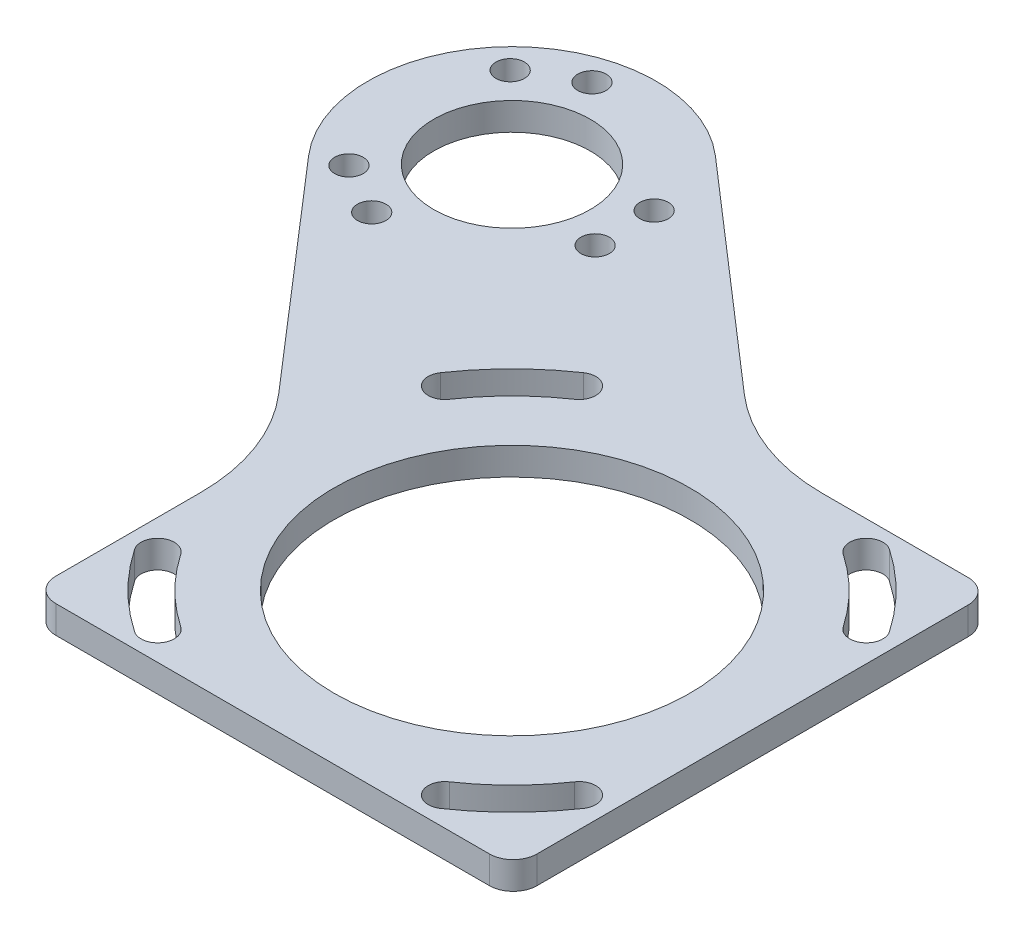
from build123d import *

# Parameters (mm, degrees)
SKETCH1_R           = 23.8125
SKETCH1_R_2         = 10.4775
SKETCH1_R_3         = 1.905
BOSS_EXTRUDE1_DEPTH = 3.683


with BuildPart() as part:
    # Sketch1 → Boss-Extrude1 (new body)
    with BuildSketch(Plane(origin=(0, 0, 0), x_dir=(1, 0, 0), z_dir=(0, 1, 0))):
        with BuildLine():
            Line((-8.06473402, -4.72806869), (-8.06473402, 14.671308994))
            ThreePointArc((-8.06473402, 14.671308994), (-9.661605647, 23.535341917), (-14.251433206, 31.284829748))
            Line((-14.251433206, 31.284829748), (-39.858713959, 60.899286273))
            ThreePointArc((-39.858713959, 60.899286273), (-38.889761495, 87.184032671), (-12.602664438, 88.086967018))
            Line((-12.602664438, 88.086967018), (16.963304526, 62.391553913))
            ThreePointArc((16.963304526, 62.391553913), (24.731110608, 57.771090259), (33.625027761, 56.16306869))
            Line((33.625027761, 56.16306869), (53.14973402, 56.16306869))
            ThreePointArc((53.14973402, 56.16306869), (55.39479805, 55.23313272), (56.32473402, 52.98806869))
            Line((56.32473402, 52.98806869), (56.32473402, -4.72806869))
            ThreePointArc((56.32473402, -4.72806869), (55.39479805, -6.97313272), (53.14973402, -7.90306869))
            Line((53.14973402, -7.90306869), (-4.88973402, -7.90306869))
            ThreePointArc((-4.88973402, -7.90306869), (-7.13479805, -6.97313272), (-8.06473402, -4.72806869))
        make_face()
        with Locations(Location((24.13, 24.13, 0), (0, 0, 270))):
            Circle(SKETCH1_R, mode=Mode.SUBTRACT)
        with Locations(Location((-25.261408666, 73.521408666, 0), (0, 0, 270))):
            Circle(SKETCH1_R_2, mode=Mode.SUBTRACT)
        with Locations(Location((-36.294042469, 84.309426168, 0), (0, 0, 270))):
            Circle(SKETCH1_R_3, mode=Mode.SUBTRACT)
        with Locations(Location((-29.421941059, 88.38042278, 0), (0, 0, 270))):
            Circle(SKETCH1_R_3, mode=Mode.SUBTRACT)
        with Locations(Location((-10.402394551, 77.681941059, 0), (0, 0, 270))):
            Circle(SKETCH1_R_3, mode=Mode.SUBTRACT)
        with Locations(Location((-10.312858771, 69.695028354, 0), (0, 0, 270))):
            Circle(SKETCH1_R_3, mode=Mode.SUBTRACT)
        with Locations(Location((-29.087788977, 58.572858771, 0), (0, 0, 270))):
            Circle(SKETCH1_R_3, mode=Mode.SUBTRACT)
        with Locations(Location((-36.049426168, 62.488774863, 0), (0, 0, 270))):
            Circle(SKETCH1_R_3, mode=Mode.SUBTRACT)
        with BuildLine():
            ThreePointArc((44.60009114, -5.905215683), (49.831544821, -1.571544821), (54.165215683, 3.65990886))
            ThreePointArc((54.165215683, 3.65990886), (53.580347261, 6.748102738), (50.492153383, 6.163234317))
            ThreePointArc((50.492153383, 6.163234317), (46.688455179, 1.571544821), (42.096765683, -2.232153383))
            ThreePointArc((42.096765683, -2.232153383), (41.511897262, -5.320347261), (44.60009114, -5.905215683))
        make_face(mode=Mode.SUBTRACT)
        with BuildLine():
            ThreePointArc((44.60009114, 54.165215683), (49.831544821, 49.831544821), (54.165215683, 44.60009114))
            ThreePointArc((54.165215683, 44.60009114), (53.580347261, 41.511897262), (50.492153383, 42.096765683))
            ThreePointArc((50.492153383, 42.096765683), (46.688455179, 46.688455179), (42.096765683, 50.492153383))
            ThreePointArc((42.096765683, 50.492153383), (41.511897262, 53.580347261), (44.60009114, 54.165215683))
        make_face(mode=Mode.SUBTRACT)
        with BuildLine():
            ThreePointArc((3.65990886, -5.905215683), (-1.571544821, -1.571544821), (-5.905215683, 3.65990886))
            ThreePointArc((-5.905215683, 3.65990886), (-5.320347261, 6.748102738), (-2.232153383, 6.163234317))
            ThreePointArc((-2.232153383, 6.163234317), (1.571544821, 1.571544821), (6.163234317, -2.232153383))
            ThreePointArc((6.163234317, -2.232153383), (6.748102738, -5.320347261), (3.65990886, -5.905215683))
        make_face(mode=Mode.SUBTRACT)
        with BuildLine():
            ThreePointArc((3.65990886, 54.165215683), (-1.571544821, 49.831544821), (-5.905215683, 44.60009114))
            ThreePointArc((-5.905215683, 44.60009114), (-5.320347261, 41.511897262), (-2.232153383, 42.096765683))
            ThreePointArc((-2.232153383, 42.096765683), (1.571544821, 46.688455179), (6.163234317, 50.492153383))
            ThreePointArc((6.163234317, 50.492153383), (6.748102738, 53.580347261), (3.65990886, 54.165215683))
        make_face(mode=Mode.SUBTRACT)
    extrude(amount=BOSS_EXTRUDE1_DEPTH)


solid = part.part
